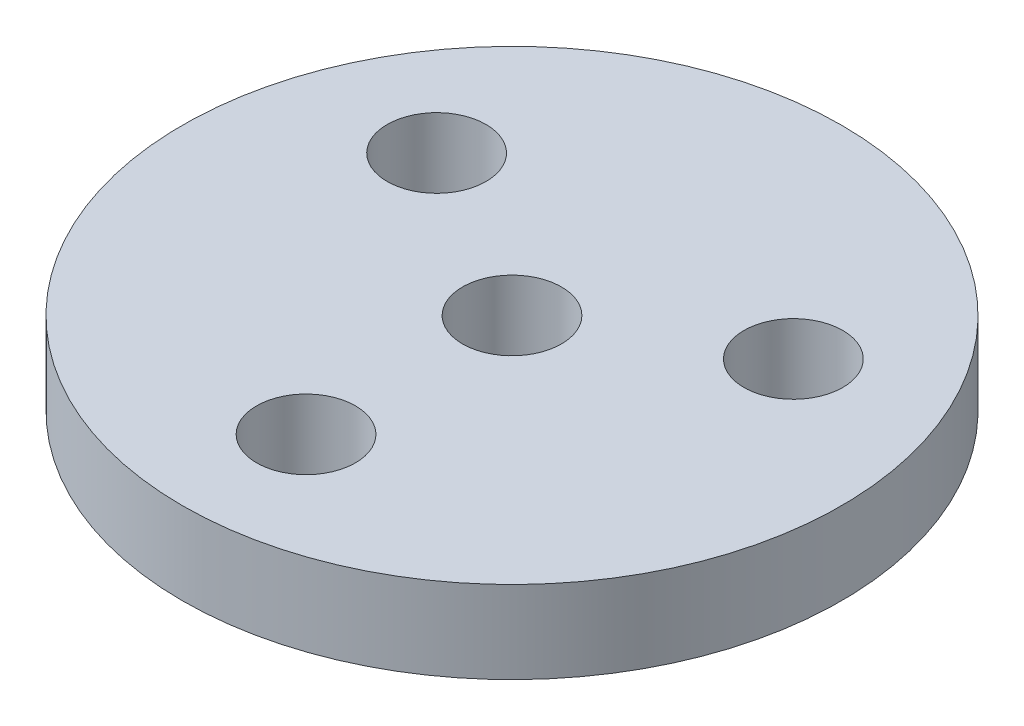
from build123d import *

# Parameters (mm, degrees)
SKETCH_4_R               = 8
SKETCH_4_R_2             = 1.2
EXTRUDE_1_DEPTH          = 2
SKETCH_5_R               = 1.2
CUT_EXTRUDE_1_DEPTH      = 12.489125293
PATTERN_CIRCULAR_1_COUNT = 3


with BuildPart() as part:
    # 草图4 → 凸台-拉伸1 (new body)
    with BuildSketch(Plane(origin=(0, 0, 0), x_dir=(1, 0, 0), z_dir=(0, 1, 0))):
        with Locations(Location((0, 0, 0), (0, 0, 270))):
            Circle(SKETCH_4_R)
        with Locations(Location((0, 0, 0), (0, 0, 270))):
            Circle(SKETCH_4_R_2, mode=Mode.SUBTRACT)
    extrude(amount=EXTRUDE_1_DEPTH)

    # 草图5 → 切除-拉伸1 (cut, through all)
    with BuildSketch(Plane.XZ):
        with Locations(Location((0, 5, 0), (0, 0, 270))):
            Circle(SKETCH_5_R)
    cut_extrude_1 = extrude(amount=-CUT_EXTRUDE_1_DEPTH, mode=Mode.SUBTRACT)

    # 阵列(圆周)1: 切除-拉伸1 ×3 about axis
    pattern_circular_1_axis = Axis((0, 0, 0), (0, 1, 0))
    for i in range(1, PATTERN_CIRCULAR_1_COUNT):
        add(cut_extrude_1.rotate(pattern_circular_1_axis, i * 360 / PATTERN_CIRCULAR_1_COUNT), mode=Mode.SUBTRACT)


solid = part.part
